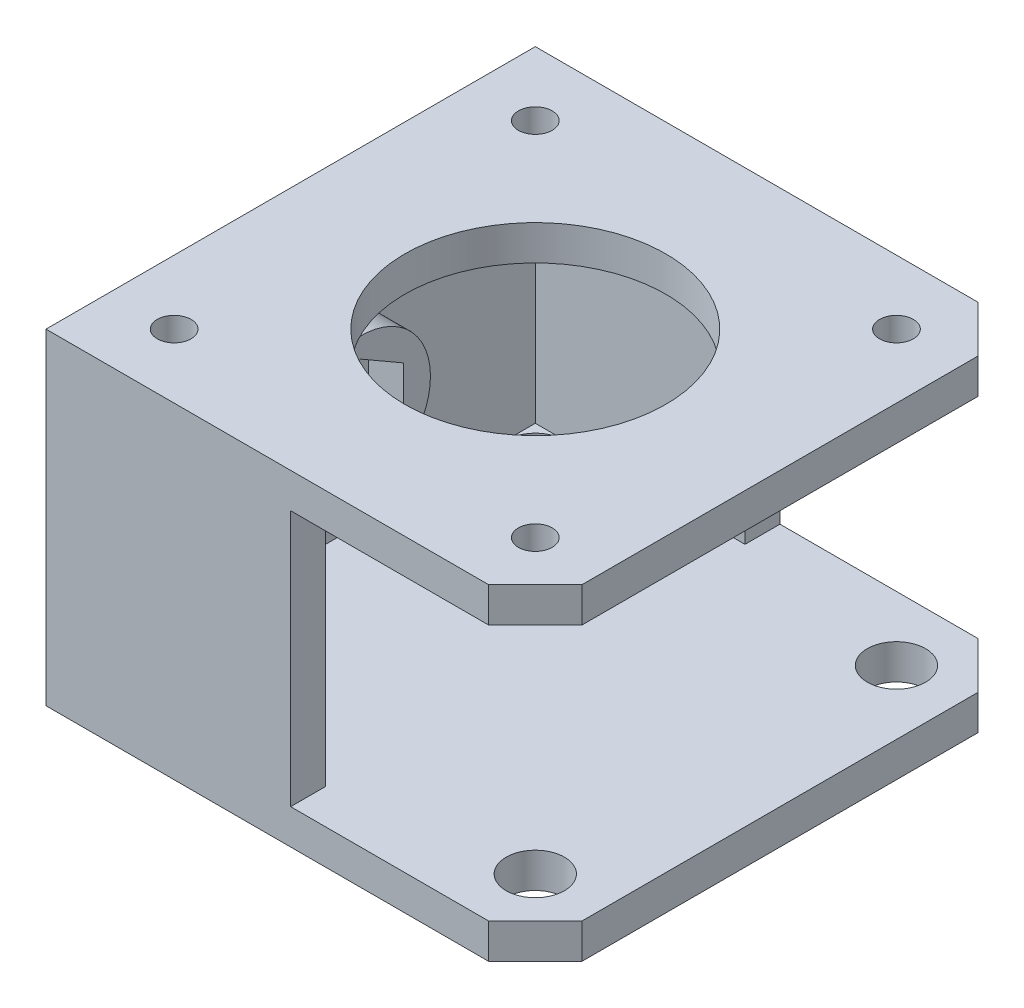
from build123d import *

# Parameters (mm, degrees)
SKETCH1_W           = 42
SKETCH1_H           = 42
SKETCH1_W_2         = 36
SKETCH1_H_2         = 36
SKETCH1_R           = 1.45
SKETCH1_R_2         = 11.2
BOSS_EXTRUDE1_DEPTH = 3
BOSS_EXTRUDE2_DEPTH = 25
BOSS_EXTRUDE3_START = -25
SKETCH1_4_W         = 36
SKETCH1_4_H         = 36
SKETCH1_4_R         = 1.45
SKETCH1_4_R_2       = 11.2
BOSS_EXTRUDE3_DEPTH = 3
SKETCH3_R           = 2.2
CUT_EXTRUDE1_DEPTH  = 51.862559904
SKETCH3_3_R         = 6
BOSS_EXTRUDE4_DEPTH = 3
SKETCH2_R           = 2.5
CUT_EXTRUDE2_DEPTH  = 39.820097888
CHAMFER1_SIZE       = 4


with BuildPart() as part:
    # Sketch1 → Boss-Extrude1 (new body)
    # profile 1 of 3: a face of its own
    with BuildSketch(Plane(origin=(0, 0, 0), x_dir=(1, 0, 0), z_dir=(0, 1, 0))):
        Rectangle(SKETCH1_W, SKETCH1_H)
        Rectangle(SKETCH1_W_2, SKETCH1_H_2, mode=Mode.SUBTRACT)
    # profile 2 of 3: a face of its own
    with BuildSketch(Plane(origin=(0, 0, 0), x_dir=(1, 0, 0), z_dir=(0, 1, 0))):
        Rectangle(SKETCH1_W_2, SKETCH1_H_2)
        with Locations(Location((-15.5, -15.5, 0), (0, 0, 270))):
            Circle(SKETCH1_R, mode=Mode.SUBTRACT)
        with Locations(Location((15.5, -15.5, 0), (0, 0, 270))):
            Circle(SKETCH1_R, mode=Mode.SUBTRACT)
        with Locations(Location((15.5, 15.5, 0), (0, 0, 270))):
            Circle(SKETCH1_R, mode=Mode.SUBTRACT)
        with Locations(Location((-15.5, 15.5, 0), (0, 0, 270))):
            Circle(SKETCH1_R, mode=Mode.SUBTRACT)
        with Locations(Location((0, 0, 0), (0, 0, 270))):
            Circle(SKETCH1_R_2, mode=Mode.SUBTRACT)
    # profile 3 of 3: a face of its own
    with BuildSketch(Plane(origin=(0, 0, 0), x_dir=(1, 0, 0), z_dir=(0, 1, 0))):
        Polygon((0, 18), (0, 21), (-21, 21), (-21, -21), (0, -21), (0, -18), (-18, -18), (-18, 18), align=None)
    extrude(amount=BOSS_EXTRUDE1_DEPTH)

    # Sketch1<3> → Boss-Extrude2 (add)
    with BuildSketch(Plane(origin=(0, 0, 0), x_dir=(1, 0, 0), z_dir=(0, 1, 0))):
        Polygon((0, 18), (0, 21), (-21, 21), (-21, -21), (0, -21), (0, -18), (-18, -18), (-18, 18), align=None)
    extrude(amount=-BOSS_EXTRUDE2_DEPTH)

    # Sketch1<4> → Boss-Extrude3 (add)
    # profile 1 of 8: a face of its own
    with BuildSketch(Plane(origin=(0, 0, 0), x_dir=(1, 0, 0), z_dir=(0, 1, 0)).offset(BOSS_EXTRUDE3_START)):
        Polygon((0, 18), (0, 21), (-21, 21), (-21, -21), (0, -21), (0, -18), (-18, -18), (-18, 18), align=None)
    # profile 2 of 8: a face of its own
    with BuildSketch(Plane(origin=(0, 0, 0), x_dir=(1, 0, 0), z_dir=(0, 1, 0)).offset(BOSS_EXTRUDE3_START)):
        Polygon((21, 21), (0, 21), (0, 18), (18, 18), (18, -18), (0, -18), (0, -21), (21, -21), align=None)
    # profile 3 of 8: a face of its own
    with BuildSketch(Plane(origin=(0, 0, 0), x_dir=(1, 0, 0), z_dir=(0, 1, 0)).offset(BOSS_EXTRUDE3_START)):
        Rectangle(SKETCH1_4_W, SKETCH1_4_H)
        with Locations(Location((-15.5, -15.5, 0), (0, 0, 270))):
            Circle(SKETCH1_4_R, mode=Mode.SUBTRACT)
        with Locations(Location((15.5, -15.5, 0), (0, 0, 270))):
            Circle(SKETCH1_4_R, mode=Mode.SUBTRACT)
        with Locations(Location((15.5, 15.5, 0), (0, 0, 270))):
            Circle(SKETCH1_4_R, mode=Mode.SUBTRACT)
        with Locations(Location((-15.5, 15.5, 0), (0, 0, 270))):
            Circle(SKETCH1_4_R, mode=Mode.SUBTRACT)
        with Locations(Location((0, 0, 0), (0, 0, 270))):
            Circle(SKETCH1_4_R_2, mode=Mode.SUBTRACT)
    # profile 4 of 8: a face of its own
    with BuildSketch(Plane(origin=(0, 0, 0), x_dir=(1, 0, 0), z_dir=(0, 1, 0)).offset(BOSS_EXTRUDE3_START)):
        with Locations(Location((-15.5, -15.5, 0), (0, 0, 270))):
            Circle(SKETCH1_4_R)
    # profile 5 of 8: a face of its own
    with BuildSketch(Plane(origin=(0, 0, 0), x_dir=(1, 0, 0), z_dir=(0, 1, 0)).offset(BOSS_EXTRUDE3_START)):
        with Locations(Location((15.5, -15.5, 0), (0, 0, 270))):
            Circle(SKETCH1_4_R)
    # profile 6 of 8: a face of its own
    with BuildSketch(Plane(origin=(0, 0, 0), x_dir=(1, 0, 0), z_dir=(0, 1, 0)).offset(BOSS_EXTRUDE3_START)):
        with Locations(Location((0, 0, 0), (0, 0, 270))):
            Circle(SKETCH1_4_R_2)
    # profile 7 of 8: a face of its own
    with BuildSketch(Plane(origin=(0, 0, 0), x_dir=(1, 0, 0), z_dir=(0, 1, 0)).offset(BOSS_EXTRUDE3_START)):
        with Locations(Location((-15.5, 15.5, 0), (0, 0, 270))):
            Circle(SKETCH1_4_R)
    # profile 8 of 8: a face of its own
    with BuildSketch(Plane(origin=(0, 0, 0), x_dir=(1, 0, 0), z_dir=(0, 1, 0)).offset(BOSS_EXTRUDE3_START)):
        with Locations(Location((15.5, 15.5, 0), (0, 0, 270))):
            Circle(SKETCH1_4_R)
    extrude(amount=BOSS_EXTRUDE3_DEPTH)

    # Sketch3 → Cut-Extrude1 (cut, through all)
    with BuildSketch(Plane(origin=(-18, 0, 0), x_dir=(0, 0, -1), z_dir=(1, 0, 0))):
        with Locations((0, -11)):
            Circle(SKETCH3_R)
    extrude(amount=-CUT_EXTRUDE1_DEPTH, mode=Mode.SUBTRACT)

    # Sketch3<3> → Boss-Extrude4 (add)
    with BuildSketch(Plane(origin=(-18, 0, 0), x_dir=(0, 0, -1), z_dir=(1, 0, 0))):
        with Locations((0, -11)):
            Circle(SKETCH3_3_R)
        Polygon((3.7, -8.863804004), (0, -6.727608008), (-3.7, -8.863804004), (-3.7, -13.136195996), (0, -15.272391992), (3.7, -13.136195996), align=None, mode=Mode.SUBTRACT)
    extrude(amount=BOSS_EXTRUDE4_DEPTH)

    # Sketch2 → Cut-Extrude2 (cut, through all)
    with BuildSketch(Plane(origin=(0, -22, 0), x_dir=(1, 0, 0), z_dir=(0, 1, 0))):
        with Locations(Location((15.5, 15.5, 0), (0, 0, 270))):
            Circle(SKETCH2_R)
        with Locations(Location((15.5, -15.5, 0), (0, 0, 270))):
            Circle(SKETCH2_R)
        with Locations(Location((-15.5, -15.5, 0), (0, 0, 270))):
            Circle(SKETCH2_R)
        with Locations(Location((-15.5, 15.5, 0), (0, 0, 270))):
            Circle(SKETCH2_R)
    extrude(amount=-CUT_EXTRUDE2_DEPTH, mode=Mode.SUBTRACT)

    # Chamfer1
    chamfer1_edges = [part.edges().sort_by_distance(p)[0] for p in [
        (21, 1.5, -21),
        (21, 1.5, 21),
        (21, -23.5, -21),
        (21, -23.5, 21),
    ]]
    chamfer(chamfer1_edges, length=CHAMFER1_SIZE)


solid = part.part
